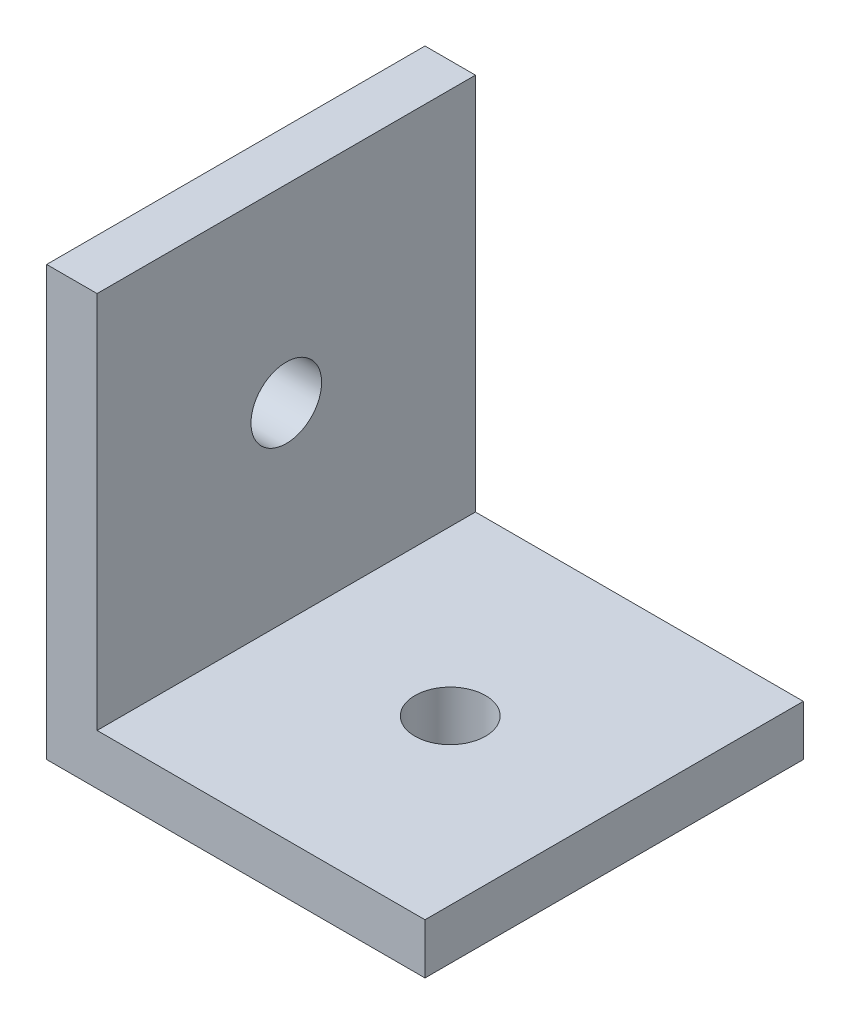
from build123d import *

# Parameters (mm, degrees)
SKETCH2_W           = 15
SKETCH2_H           = 15
BOSS_EXTRUDE1_DEPTH = 2
SKETCH3_W           = 2
SKETCH3_H           = 15
BOSS_EXTRUDE2_DEPTH = 15
SKETCH4_R           = 1.4
CUT_EXTRUDE1_DEPTH  = 15
SKETCH5_R           = 1.4
CUT_EXTRUDE2_DEPTH  = 15


with BuildPart() as part:
    # Sketch2 → Boss-Extrude1 (new body)
    with BuildSketch(Plane(origin=(0, 0, 0), x_dir=(1, 0, 0), z_dir=(0, 1, 0))):
        with Locations((1.478873239, -3.38028169)):
            Rectangle(SKETCH2_W, SKETCH2_H)
    extrude(amount=BOSS_EXTRUDE1_DEPTH)

    # Sketch3 → Boss-Extrude2 (add)
    with BuildSketch(Plane(origin=(0, 2, 0), x_dir=(1, 0, 0), z_dir=(0, 1, 0))):
        with Locations((-5.021126761, -3.38028169)):
            Rectangle(SKETCH3_W, SKETCH3_H)
    extrude(amount=BOSS_EXTRUDE2_DEPTH)

    # Sketch4 → Cut-Extrude1 (cut)
    with BuildSketch(Plane(origin=(0, 2, 0), x_dir=(1, 0, 0), z_dir=(0, 1, 0))):
        with Locations(Location((2.478873239, -3.38028169, 0), (0, 0, 270))):
            Circle(SKETCH4_R)
    extrude(amount=-CUT_EXTRUDE1_DEPTH, mode=Mode.SUBTRACT)

    # Sketch5 → Cut-Extrude2 (cut)
    with BuildSketch(Plane(origin=(-4.021126761, 0, 0), x_dir=(0, 0, -1), z_dir=(1, 0, 0))):
        with Locations((-3.38028169, 9.5)):
            Circle(SKETCH5_R)
    extrude(amount=-CUT_EXTRUDE2_DEPTH, mode=Mode.SUBTRACT)


solid = part.part
